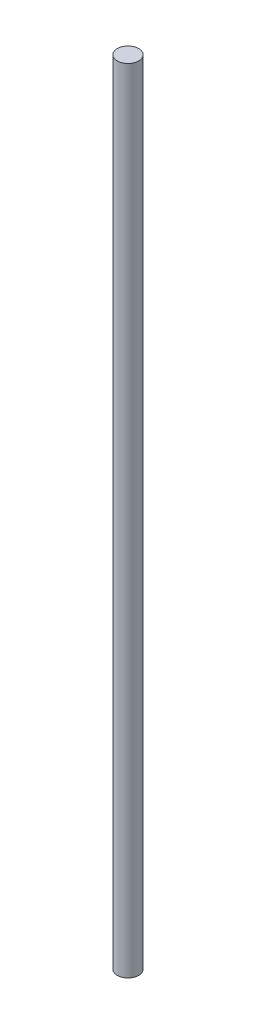
from build123d import *


with BuildPart() as part:
    # Sketch1 → Revolve1 (revolve)
    with BuildSketch(Plane.XY, mode=Mode.PRIVATE) as revolve1_sk:
        Polygon((2.5, 92.25), (0, 92.25), (0, 90.75), (1, 90.75), (1, -90.75), (0, -90.75), (0, -92.25), (2.5, -92.25), align=None)
    revolve(revolve1_sk.sketch.rotate(Axis((0, 92.25, 0), (0, -1, 0)), 90), axis=Axis((0, 92.25, 0), (0, -1, 0)))


solid = part.part
